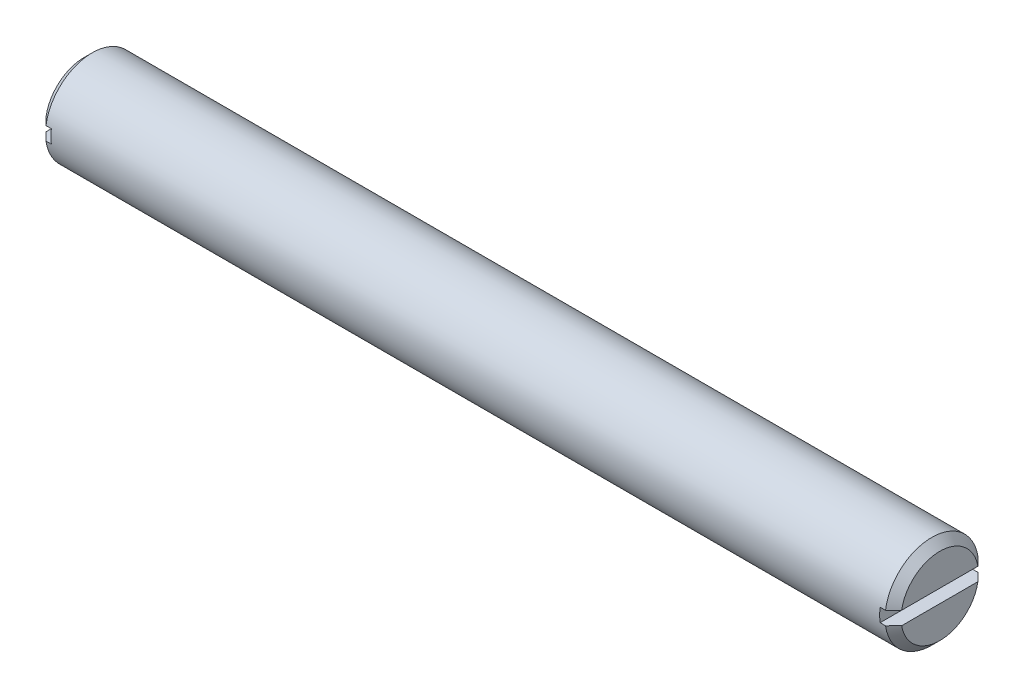
from build123d import *

# Parameters (mm, degrees)
BOSS_EXTRUDE1_DEPTH      = 50.8
BOSS_EXTRUDE1_DEPTH_BACK = 50.8
SKETCH2_R                = 5.5499
CHAMFER1_SIZE            = 0.9525
CUT_EXTRUDE1_DEPTH       = 52.402750705
CUT_EXTRUDE1_DEPTH_BACK  = 52.402750705
SKETCH5_W                = 1.5875
SKETCH5_H                = 1.5875


with BuildPart() as part:
    # Sketch2 → Boss-Extrude1 (new, two sides: drawn at the far end of the back side and taken through both)
    with BuildSketch(Plane(origin=(0, 0, 0), x_dir=(0, 0, -1), z_dir=(1, 0, 0)).offset(-BOSS_EXTRUDE1_DEPTH_BACK)):
        Circle(SKETCH2_R)
    extrude(amount=BOSS_EXTRUDE1_DEPTH + BOSS_EXTRUDE1_DEPTH_BACK)

    # Chamfer1
    chamfer1_edges = [part.edges().sort_by_distance(p)[0] for p in [
        (-50.8, 0, 5.5499),
        (50.8, 0, 5.5499),
    ]]
    chamfer(chamfer1_edges, length=CHAMFER1_SIZE)

    # Sketch5 → Cut-Extrude1 (cut, two sides: drawn at the far end of the back side and taken through both)
    with BuildSketch(Plane.XY.offset(-CUT_EXTRUDE1_DEPTH_BACK)):
        with Locations((-50.00625, 0)):
            Rectangle(SKETCH5_W, SKETCH5_H)
        with Locations((50.00625, 0)):
            Rectangle(SKETCH5_W, SKETCH5_H)
    extrude(amount=CUT_EXTRUDE1_DEPTH + CUT_EXTRUDE1_DEPTH_BACK, mode=Mode.SUBTRACT)


solid = part.part
